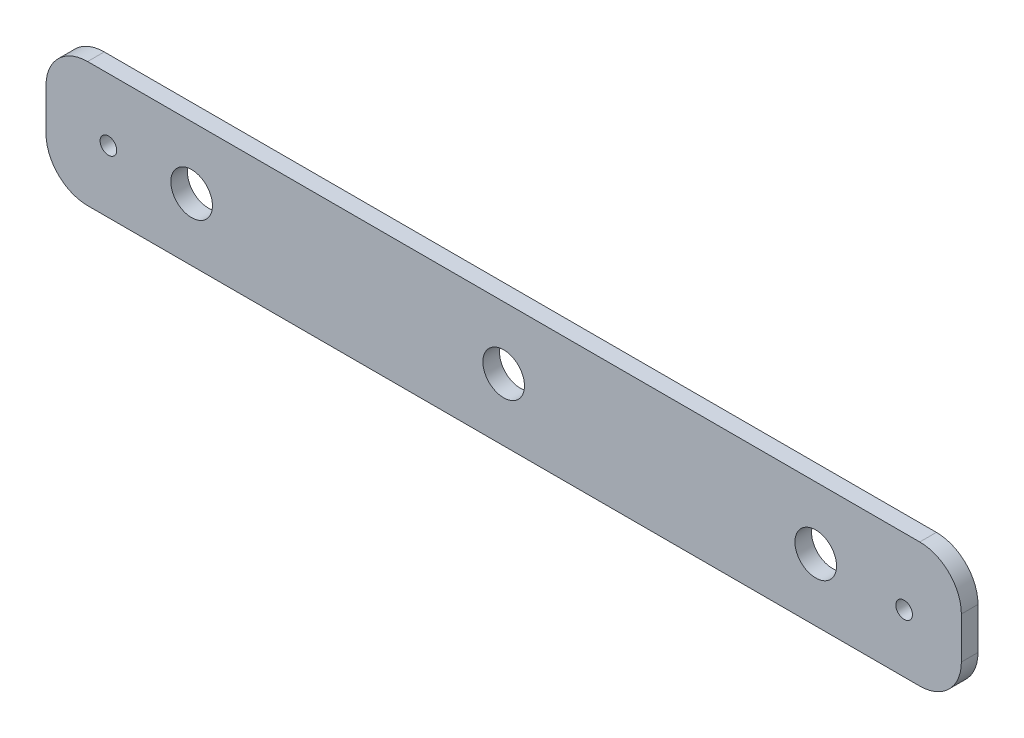
from build123d import *

# Parameters (mm, degrees)
SKETCH1_W           = 220
SKETCH1_H           = 30
SKETCH1_R           = 2
BOSS_EXTRUDE1_DEPTH = 4
FILLET1_R           = 10
SKETCH2_R           = 5
CUT_EXTRUDE1_DEPTH  = 10


with BuildPart() as part:
    # Sketch1 → Boss-Extrude1 (new body)
    with BuildSketch(Plane.XY):
        with Locations((-110, -15)):
            Rectangle(SKETCH1_W, SKETCH1_H)
        with Locations((-205, -15)):
            Circle(SKETCH1_R, mode=Mode.SUBTRACT)
        with Locations((-13.75, -16)):
            Circle(SKETCH1_R, mode=Mode.SUBTRACT)
    extrude(amount=BOSS_EXTRUDE1_DEPTH)

    # Fillet1
    fillet1_edges = [part.edges().sort_by_distance(p)[0] for p in [
        (0, -30, 2),
        (-220, -30, 2),
        (-220, 0, 2),
        (0, 0, 2),
    ]]
    fillet(fillet1_edges, radius=FILLET1_R)

    # Sketch2 → Cut-Extrude1 (cut)
    with BuildSketch(Plane.XY.offset(4)):
        with Locations((-185, -15)):
            Circle(SKETCH2_R)
        with Locations((-110, -15)):
            Circle(SKETCH2_R)
        with Locations((-35, -15)):
            Circle(SKETCH2_R)
    extrude(amount=-CUT_EXTRUDE1_DEPTH, mode=Mode.SUBTRACT)


solid = part.part
